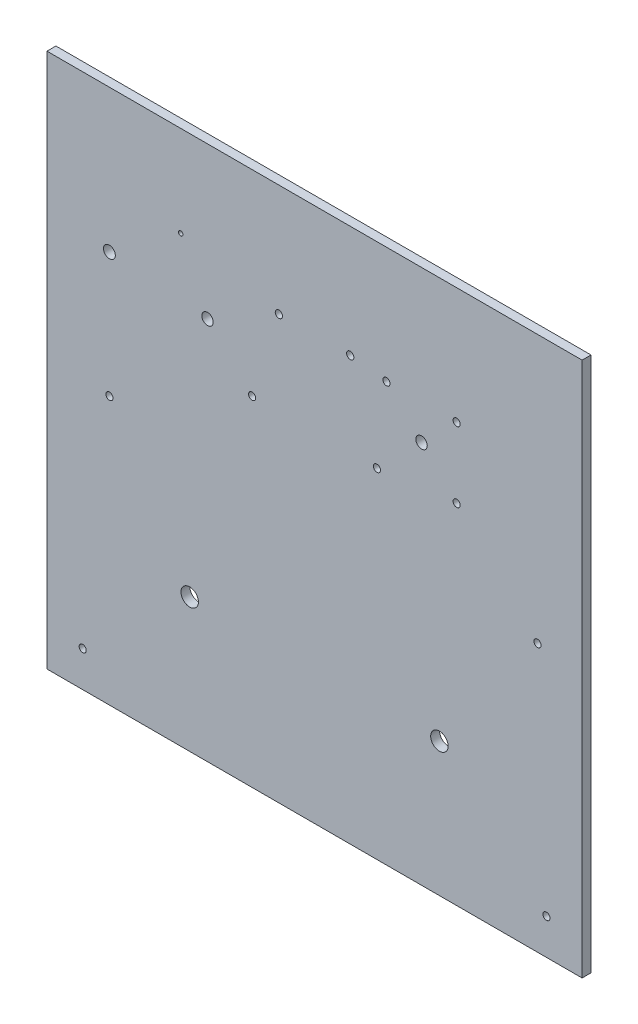
from build123d import *

# Parameters (mm, degrees)
SKETCH1_W               = 381
SKETCH1_H               = 381
SKETCH1_R               = 4.064
SKETCH1_R_2             = 2.54
SKETCH1_R_3             = 6.223
SKETCH1_R_4             = 2.5796875
SKETCH1_R_5             = 1.5875
BOSS_EXTRUDE1_DEPTH     = 6.35
F_3_8_24_TAPPED_HOLE2_D = 8.4328


with BuildPart() as part:
    # Sketch1 → Boss-Extrude1 (new body)
    with BuildSketch(Plane.XY):
        with Locations((0, 190.5)):
            Rectangle(SKETCH1_W, SKETCH1_H)
        with Locations((76.2, 273.05)):
            Circle(SKETCH1_R, mode=Mode.SUBTRACT)
        with Locations((44.45, 241.3)):
            Circle(SKETCH1_R_2, mode=Mode.SUBTRACT)
        with Locations((88.9, 95.25)):
            Circle(SKETCH1_R_3, mode=Mode.SUBTRACT)
        with Locations(Location((-165.1, 25.4, 0), (0, 0, 180))):
            Circle(SKETCH1_R_2, mode=Mode.SUBTRACT)
        with Locations((101.2, 298.05)):
            Circle(SKETCH1_R_2, mode=Mode.SUBTRACT)
        with Locations((158.75, 190.5)):
            Circle(SKETCH1_R_2, mode=Mode.SUBTRACT)
        with Locations((101.2, 248.05)):
            Circle(SKETCH1_R_2, mode=Mode.SUBTRACT)
        with Locations((165.1, 25.4)):
            Circle(SKETCH1_R_2, mode=Mode.SUBTRACT)
        with Locations(Location((-88.9, 95.25, 0), (0, 0, 180))):
            Circle(SKETCH1_R_3, mode=Mode.SUBTRACT)
        with Locations(Location((-146.05, 190.5, 0), (0, 0, 180))):
            Circle(SKETCH1_R_2, mode=Mode.SUBTRACT)
        with Locations((51.2, 298.05)):
            Circle(SKETCH1_R_2, mode=Mode.SUBTRACT)
        with Locations((-25.4, 301.365)):
            Circle(SKETCH1_R_4, mode=Mode.SUBTRACT)
        with Locations((25.4, 301.365)):
            Circle(SKETCH1_R_4, mode=Mode.SUBTRACT)
        with Locations(Location((-44.45, 241.3, 0), (0, 0, 180))):
            Circle(SKETCH1_R_2, mode=Mode.SUBTRACT)
        with Locations(Location((-76.2, 273.05, 0), (0, 0, 180))):
            Circle(SKETCH1_R, mode=Mode.SUBTRACT)
        with Locations((-95.25, 316.23)):
            Circle(SKETCH1_R_5, mode=Mode.SUBTRACT)
    extrude(amount=BOSS_EXTRUDE1_DEPTH)

    # 3/8-24 Tapped Hole2 (through all)
    with Locations(Plane.XY.offset(6.35)):
        with Locations((-146.05, 279.4)):
            Hole(F_3_8_24_TAPPED_HOLE2_D / 2)


solid = part.part
